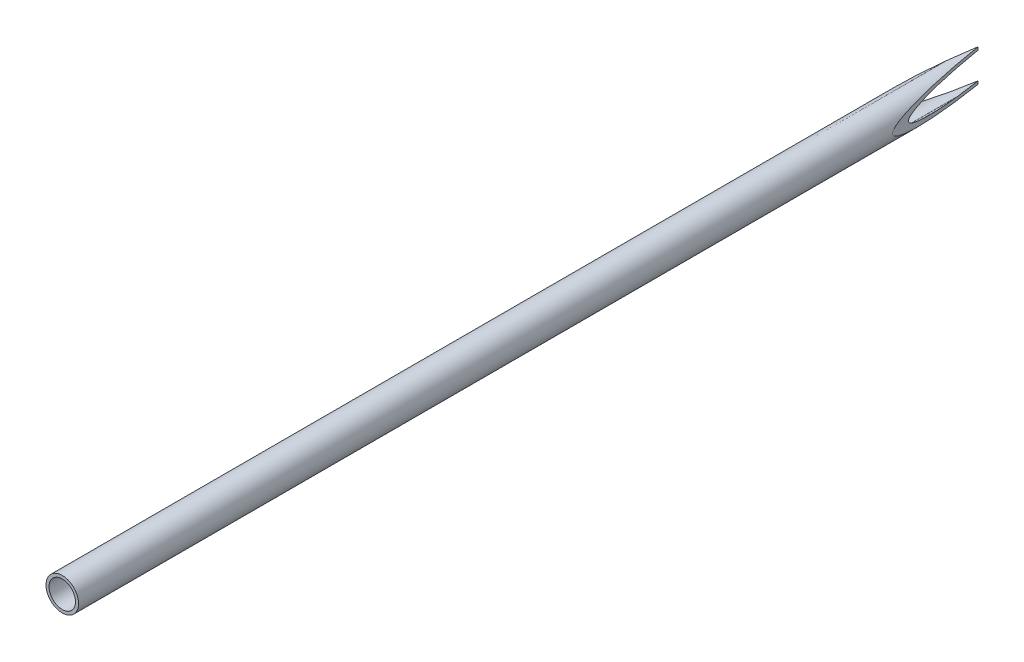
from build123d import *

# Parameters (mm, degrees)
ESQUISSE1_R                  = 16
ESQUISSE1_R_2                = 13
BOSS_EXTRU_1_DEPTH           = 900
ENL_V_MAT_EXTRU_1_DEPTH      = 901.284399509
ENL_V_MAT_EXTRU_1_DEPTH_BACK = 901.284399509
ENL_V_MAT_EXTRU_2_DEPTH      = 901.284399509
ENL_V_MAT_EXTRU_2_DEPTH_BACK = 901.284399509


with BuildPart() as part:
    # Esquisse1 → Boss.-Extru.1 (new body)
    with BuildSketch(Plane.XY):
        Circle(ESQUISSE1_R)
        Circle(ESQUISSE1_R_2, mode=Mode.SUBTRACT)
    extrude(amount=BOSS_EXTRU_1_DEPTH)

    # Esquisse2 → Enlèv. mat.-Extru.1 (cut, two sides: drawn at the far end of the back side and taken through both)
    with BuildSketch(Plane(origin=(0, 0, 0), x_dir=(1, 0, 0), z_dir=(0, 1, 0)).offset(-ENL_V_MAT_EXTRU_1_DEPTH_BACK)):
        Polygon((0, 0), (16, -100), (16, 0), align=None)
    extrude(amount=ENL_V_MAT_EXTRU_1_DEPTH + ENL_V_MAT_EXTRU_1_DEPTH_BACK, mode=Mode.SUBTRACT)

    # Esquisse3 → Enlèv. mat.-Extru.2 (cut, two sides: drawn at the far end of the back side and taken through both)
    with BuildSketch(Plane(origin=(0, 0, 0), x_dir=(1, 0, 0), z_dir=(0, 1, 0)).offset(-ENL_V_MAT_EXTRU_2_DEPTH_BACK)):
        Polygon((0, 0), (-16, -100), (-16, 0), align=None)
    extrude(amount=ENL_V_MAT_EXTRU_2_DEPTH + ENL_V_MAT_EXTRU_2_DEPTH_BACK, mode=Mode.SUBTRACT)


solid = part.part
